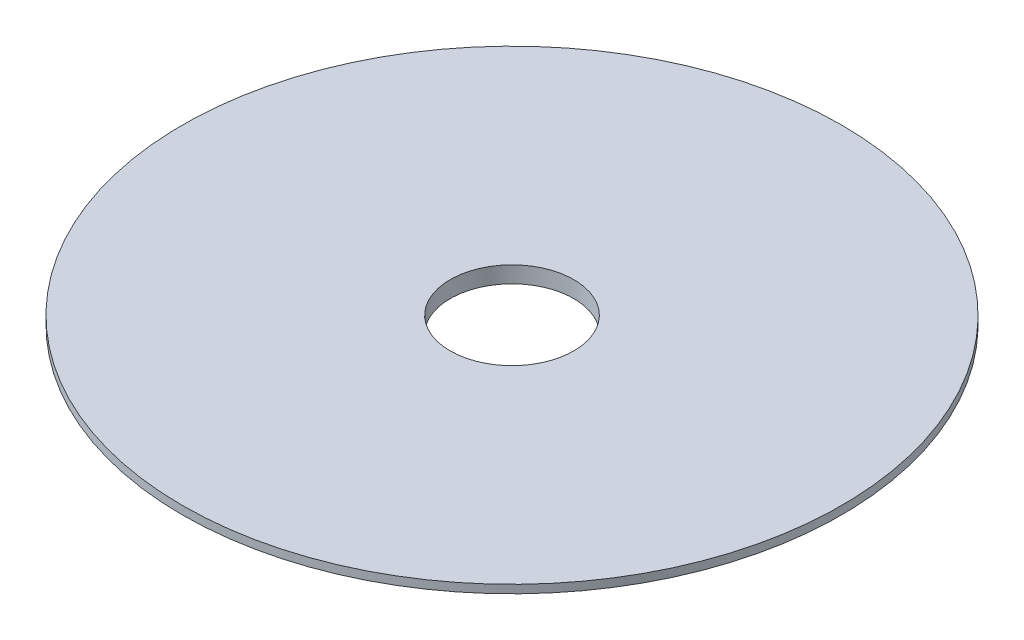
from build123d import *

# Parameters (mm, degrees)
SKETCH_1_R          = 22.5
EXTRUDE_1_DEPTH     = 1
SKETCH_2_R          = 40
EXTRUDE_2_DEPTH     = 1
SKETCH_3_R          = 7.5
CUT_EXTRUDE_1_DEPTH = 500
SKETCH_5_R          = 22.5
SKETCH_5_R_2        = 15
CUT_EXTRUDE_3_DEPTH = 1


with BuildPart() as part:
    # 草图1 → 凸台-拉伸1 (new body)
    with BuildSketch(Plane(origin=(0, 0, 0), x_dir=(1, 0, 0), z_dir=(0, 1, 0))):
        with Locations(Location((0, 0, 0), (0, 0, 270))):
            Circle(SKETCH_1_R)
    extrude(amount=EXTRUDE_1_DEPTH)

    # 草图2 → 凸台-拉伸2 (add)
    with BuildSketch(Plane(origin=(0, 1, 0), x_dir=(1, 0, 0), z_dir=(0, 1, 0))):
        with Locations(Location((0, 0, 0), (0, 0, 270))):
            Circle(SKETCH_2_R)
    extrude(amount=EXTRUDE_2_DEPTH)

    # 草图3 → 切除-拉伸1 (cut)
    with BuildSketch(Plane(origin=(0, 2, 0), x_dir=(1, 0, 0), z_dir=(0, 1, 0))):
        with Locations(Location((0, 0, 0), (0, 0, 270))):
            Circle(SKETCH_3_R)
    extrude(amount=-CUT_EXTRUDE_1_DEPTH, mode=Mode.SUBTRACT)

    # 草图5 → 切除-拉伸3 (cut)
    with BuildSketch(Plane.XZ):
        Circle(SKETCH_5_R)
        with Locations(Location((0, 0, 0), (0, 0, 270))):
            Circle(SKETCH_5_R_2, mode=Mode.SUBTRACT)
    extrude(amount=-CUT_EXTRUDE_3_DEPTH, mode=Mode.SUBTRACT)


solid = part.part
